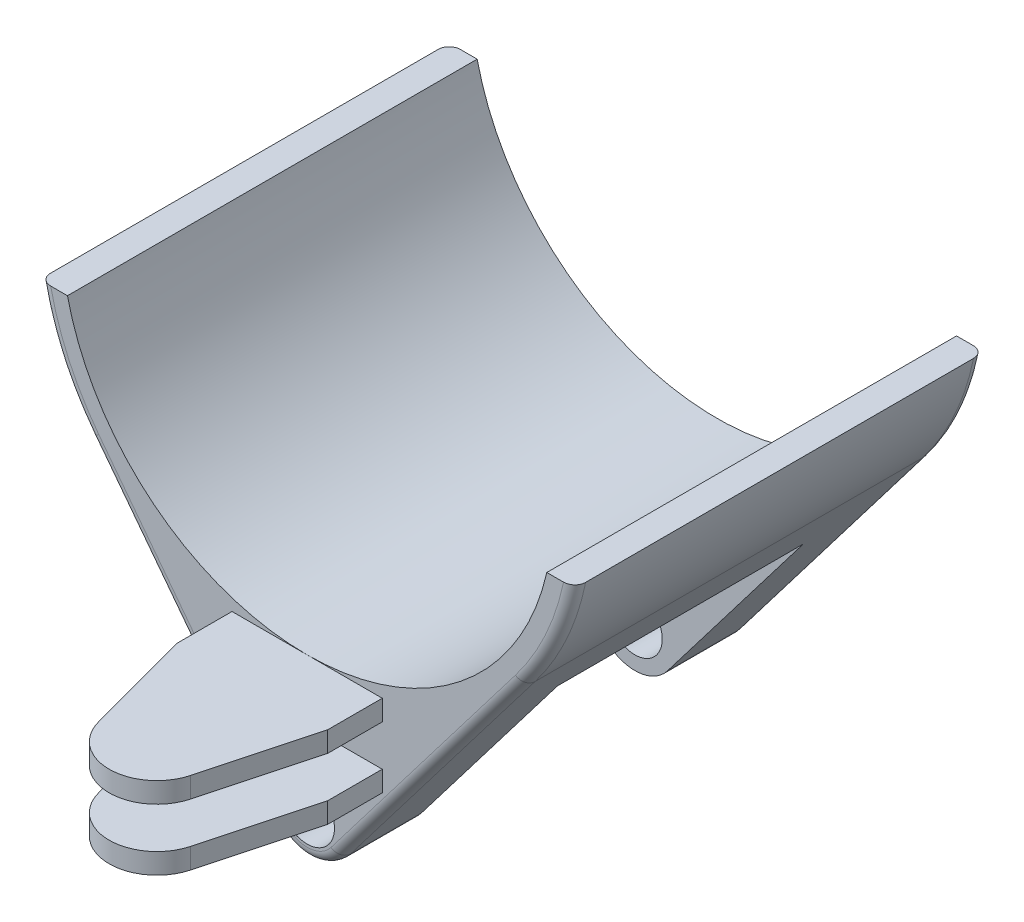
from build123d import *

# Parameters (mm, degrees)
SKETCH1_R             = 30
BOSS_EXTRUDE2_DEPTH   = 225
BOSS_EXTRUDE3_START   = 60
BOSS_EXTRUDE3_DEPTH   = 90
SKETCH3_W             = 257.405164054
SKETCH3_H             = 45
CUT_EXTRUDE1_DEPTH    = 151.9
SKETCH4_W             = 270
SKETCH4_H             = 367.4
CUT_EXTRUDE2_DEPTH    = 421.85
CHAMFER1_SIZE         = 6
CHAMFER1_SIZE2        = 32.008563289
CHAMFER1_EDGE_2_SIZE  = 6
CHAMFER1_EDGE_2_SIZE2 = 32.008563289
FILLET1_R             = 6
FILLET2_R             = 12


with BuildPart() as part:
    # Sketch1 → Boss-Extrude2 (new, symmetric)
    with BuildSketch(Plane.XY):
        with BuildLine():
            Line((238.377808514, 237.857142857), (35.756671277, -27.321428571))
            ThreePointArc((35.756671277, -27.321428571), (0, -45), (-35.756671277, -27.321428571))
            Line((-35.756671277, -27.321428571), (-238.377808514, 237.857142857))
            ThreePointArc((-238.377808514, 237.857142857), (-273.074997203, 295.782264138), (-293.938769134, 360))
            Line((-293.938769134, 360), (-263.248931622, 360))
            ThreePointArc((-263.248931622, 360), (0, 150), (263.248931622, 360))
            Line((263.248931622, 360), (293.938769134, 360))
            ThreePointArc((293.938769134, 360), (273.074997203, 295.782264138), (238.377808514, 237.857142857))
        make_face()
        Circle(SKETCH1_R, mode=Mode.SUBTRACT)
    extrude(amount=BOSS_EXTRUDE2_DEPTH, both=True)

    # Sketch2 → Boss-Extrude3 (add)
    with BuildSketch(Plane(origin=(0, 0, 0), x_dir=(1, 0, 0), z_dir=(0, 1, 0)).offset(BOSS_EXTRUDE3_START)):
        with BuildLine():
            Line((82.5, -225), (-82.5, -225))
            Line((-82.5, -225), (-82.5, -285))
            Line((-82.5, -285), (-50.709680046, -403.593320036))
            ThreePointArc((-50.709680046, -403.593320036), (0, -442.5), (50.709680046, -403.593320036))
            Line((50.709680046, -403.593320036), (82.5, -285))
            Line((82.5, -285), (82.5, -225))
        make_face()
    extrude(amount=BOSS_EXTRUDE3_DEPTH)

    # Sketch3 → Cut-Extrude1 (cut, symmetric)
    with BuildSketch(Plane(origin=(0, 0, 0), x_dir=(0, 0, -1), z_dir=(1, 0, 0))):
        with Locations((-353.702582027, 105)):
            Rectangle(SKETCH3_W, SKETCH3_H)
    extrude(amount=CUT_EXTRUDE1_DEPTH, both=True, mode=Mode.SUBTRACT)

    # Sketch4 → Cut-Extrude2 (cut, symmetric)
    with BuildSketch(Plane(origin=(0, 0, 0), x_dir=(0, 0, -1), z_dir=(1, 0, 0))):
        with Locations((0, -41.2)):
            Rectangle(SKETCH4_W, SKETCH4_H)
    extrude(amount=CUT_EXTRUDE2_DEPTH, both=True, mode=Mode.SUBTRACT)

    # Chamfer1
    chamfer1_edges = [part.edges().sort_by_distance(p)[0] for p in [
        (165.516066235, 142.5, 0),
    ]]
    chamfer1_side = [part.faces().sort_by_distance(p)[0] for p in [
        (0, 142.5, 0),
    ]]
    chamfer(chamfer1_edges, length=CHAMFER1_SIZE, length2=CHAMFER1_SIZE2, reference=chamfer1_side[0])

    # Chamfer1 edge 2
    chamfer1_edge_2_edges = [part.edges().sort_by_distance(p)[0] for p in [
        (-165.516066235, 142.5, 0),
    ]]
    chamfer1_edge_2_side = [part.faces().sort_by_distance(p)[0] for p in [
        (0, 142.5, 0),
    ]]
    chamfer(chamfer1_edge_2_edges, length=CHAMFER1_EDGE_2_SIZE, length2=CHAMFER1_EDGE_2_SIZE2, reference=chamfer1_edge_2_side[0])

    # Fillet1
    fillet1_edges = [part.edges().sort_by_distance(p)[0] for p in [
        (0, 142.5, -135),
        (0, 142.5, 135),
    ]]
    fillet(fillet1_edges, radius=FILLET1_R)

    # Fillet2
    fillet2_edges = [part.edges().sort_by_distance(p)[0] for p in [
        (273.074997203, 295.782264138, -225),
        (-273.074997203, 295.782264138, 225),
        (-137.067239895, 105.267857143, 225),
        (0, -45, 225),
        (137.067239895, 105.267857143, 225),
        (273.074997203, 295.782264138, 225),
        (137.067239895, 105.267857143, -225),
        (0, -45, -225),
        (-137.067239895, 105.267857143, -225),
        (-273.074997203, 295.782264138, -225),
    ]]
    fillet(fillet2_edges, radius=FILLET2_R)


solid = part.part
